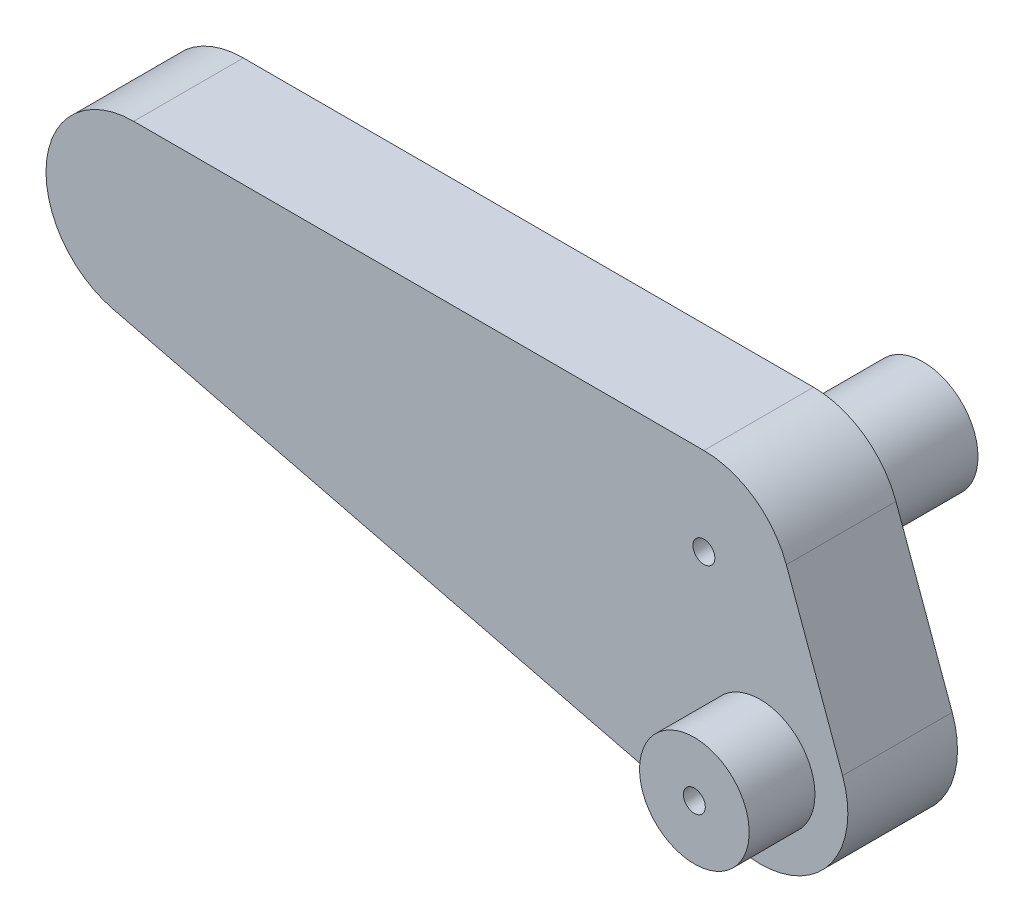
from build123d import *

# Parameters (mm, degrees)
SKETCH2_R           = 2.5
BOSS_EXTRUDE1_DEPTH = 5
BOSS_EXTRUDE2_START = -10
SKETCH3_R           = 2.5
SKETCH3_R_2         = 0.5
BOSS_EXTRUDE2_DEPTH = 10
SKETCH4_R           = 2.5
SKETCH4_R_2         = 0.5
BOSS_EXTRUDE3_DEPTH = 8
SKETCH5_R           = 2.5
BOSS_EXTRUDE4_DEPTH = 5


with BuildPart() as part:
    # Sketch2 → Boss-Extrude1 (new body)
    with BuildSketch(Plane.XY):
        with BuildLine():
            Line((-26, 4), (0, 4))
            ThreePointArc((0, 4), (2.294305745, 3.276608177), (3.758770483, 1.368080573))
            Line((3.758770483, 1.368080573), (6.323921558, -5.679614083))
            ThreePointArc((6.323921558, -5.679614083), (5.541011625, -9.720568388), (1.606989058, -10.931240143))
            Line((1.606989058, -10.931240143), (-26.958162017, -3.883545487))
            ThreePointArc((-26.958162017, -3.883545487), (-29.970779643, 0.482606492), (-26, 4))
        make_face()
        with Locations((-26, 0)):
            Circle(SKETCH2_R, mode=Mode.SUBTRACT)
        Circle(SKETCH2_R, mode=Mode.SUBTRACT)
        with Locations((2.565151075, -7.047694656)):
            Circle(SKETCH2_R, mode=Mode.SUBTRACT)
    extrude(amount=BOSS_EXTRUDE1_DEPTH)

    # Sketch3 → Boss-Extrude2 (add)
    with BuildSketch(Plane.XY.offset(5).offset(BOSS_EXTRUDE2_START)):
        Circle(SKETCH3_R)
        Circle(SKETCH3_R_2, mode=Mode.SUBTRACT)
    extrude(amount=BOSS_EXTRUDE2_DEPTH)

    # Sketch4 → Boss-Extrude3 (add)
    with BuildSketch(Plane(origin=(0, 0, 0), x_dir=(-1, 0, 0), z_dir=(0, 0, -1))):
        with Locations((-2.565151075, -7.047694656)):
            Circle(SKETCH4_R)
        with Locations((-2.565151075, -7.047694656)):
            Circle(SKETCH4_R_2, mode=Mode.SUBTRACT)
    extrude(amount=-BOSS_EXTRUDE3_DEPTH)

    # Sketch5 → Boss-Extrude4 (add)
    with BuildSketch(Plane(origin=(0, 0, 0), x_dir=(-1, 0, 0), z_dir=(0, 0, -1))):
        with Locations((26, 0)):
            Circle(SKETCH5_R)
    extrude(amount=-BOSS_EXTRUDE4_DEPTH)


solid = part.part
